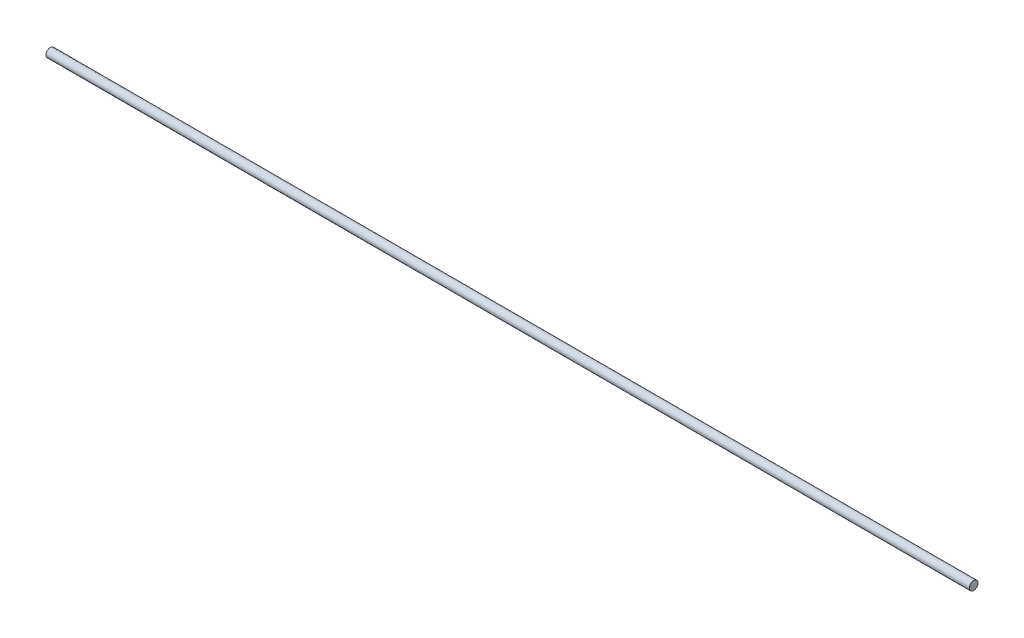
from build123d import *

# Parameters (mm, degrees)
SKETCH2_R           = 6.35
BOSS_EXTRUDE1_DEPTH = 1346.454


with BuildPart() as part:
    # Sketch2 → Boss-Extrude1 (new body)
    with BuildSketch(Plane(origin=(0, 0, 0), x_dir=(0, 0, -1), z_dir=(1, 0, 0))):
        Circle(SKETCH2_R)
    extrude(amount=BOSS_EXTRUDE1_DEPTH)


solid = part.part
